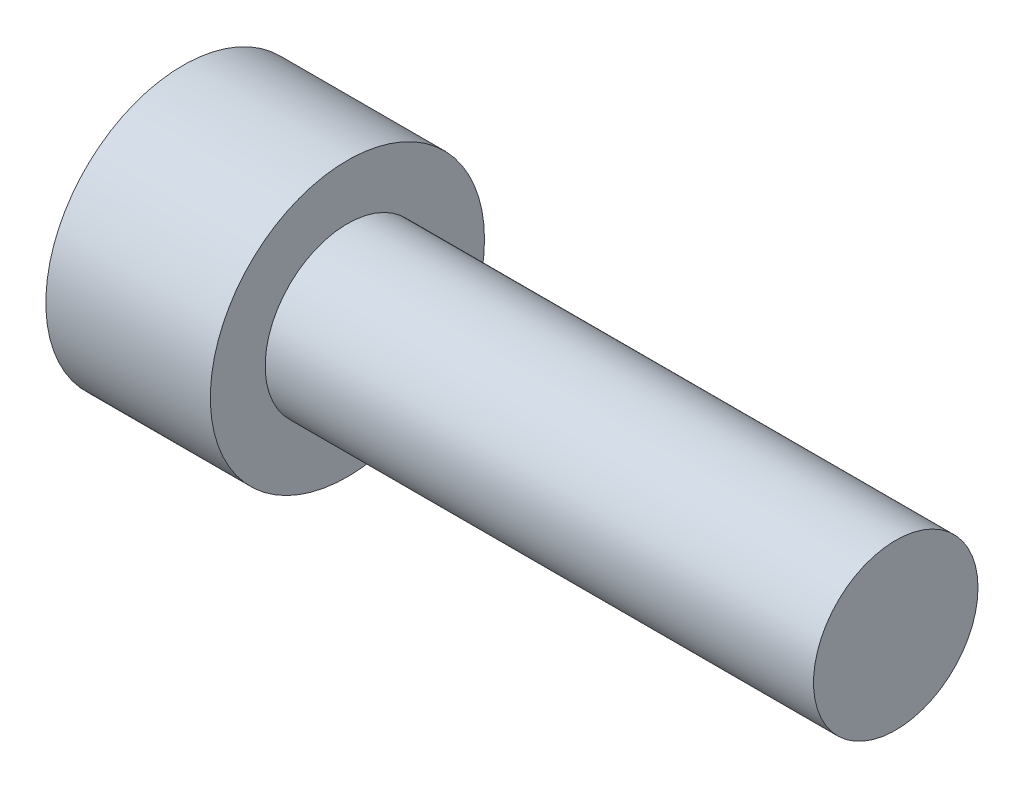
from build123d import *


with BuildPart() as part:
    # Sketch1 → Revolve1 (revolve)
    with BuildSketch(Plane(origin=(0, 0, 0), x_dir=(1, 0, 0), z_dir=(0, 1, 0))):
        Polygon((0, 0), (0, 2.5), (3, 2.5), (3, 1.5), (13, 1.5), (13, 0), align=None)
    revolve(axis=Axis((13, 0, 0), (-1, 0, 0)))


solid = part.part
